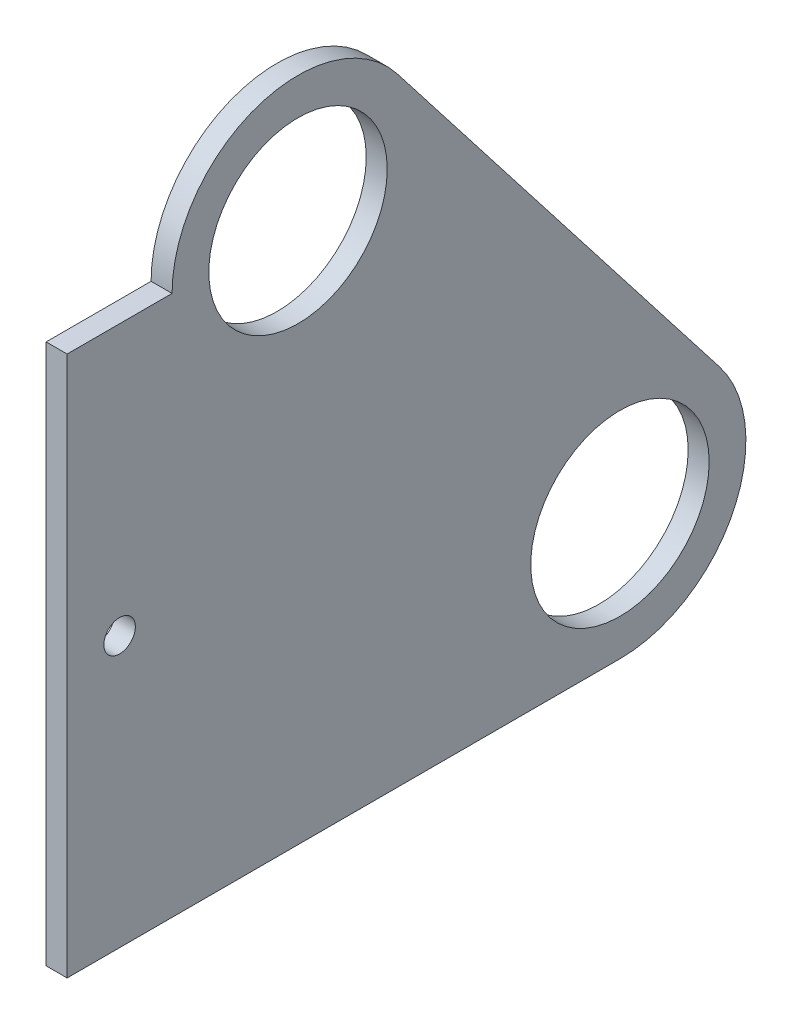
from build123d import *

# Parameters (mm, degrees)
SKETCH_1_R          = 8.5
EXTRUDE_1_DEPTH     = 2
SKETCH_2_R          = 1.5
CUT_EXTRUDE_1_DEPTH = 10


with BuildPart() as part:
    # 草图1 → 凸台-拉伸1 (new body)
    with BuildSketch(Plane(origin=(0, 0, 0), x_dir=(0, 0, -1), z_dir=(1, 0, 0))):
        with BuildLine():
            ThreePointArc((9.47672316, 7.361502438), (10.778173065, -5.275508068), (0, -12))
            Line((0, -12), (-52.672926825, -12))
            Line((-52.672926825, -12), (-52.672926825, 39.486346501))
            Line((-52.672926825, 39.486346501), (-42.672926825, 39.486346501))
            ThreePointArc((-42.672926825, 39.486346501), (-34.56389856, 50.838013293), (-21.196203665, 46.847848939))
            Line((-21.196203665, 46.847848939), (9.47672316, 7.361502438))
        make_face()
        with Locations((-30.672926825, 39.486346501)):
            Circle(SKETCH_1_R, mode=Mode.SUBTRACT)
        Circle(SKETCH_1_R, mode=Mode.SUBTRACT)
    extrude(amount=EXTRUDE_1_DEPTH)

    # 草图2 → 切除-拉伸1 (cut)
    with BuildSketch(Plane(origin=(2, 0, 0), x_dir=(0, 0, -1), z_dir=(1, 0, 0))):
        with Locations((-47.672926825, 13.74317325)):
            Circle(SKETCH_2_R)
    extrude(amount=-CUT_EXTRUDE_1_DEPTH, mode=Mode.SUBTRACT)


solid = part.part
